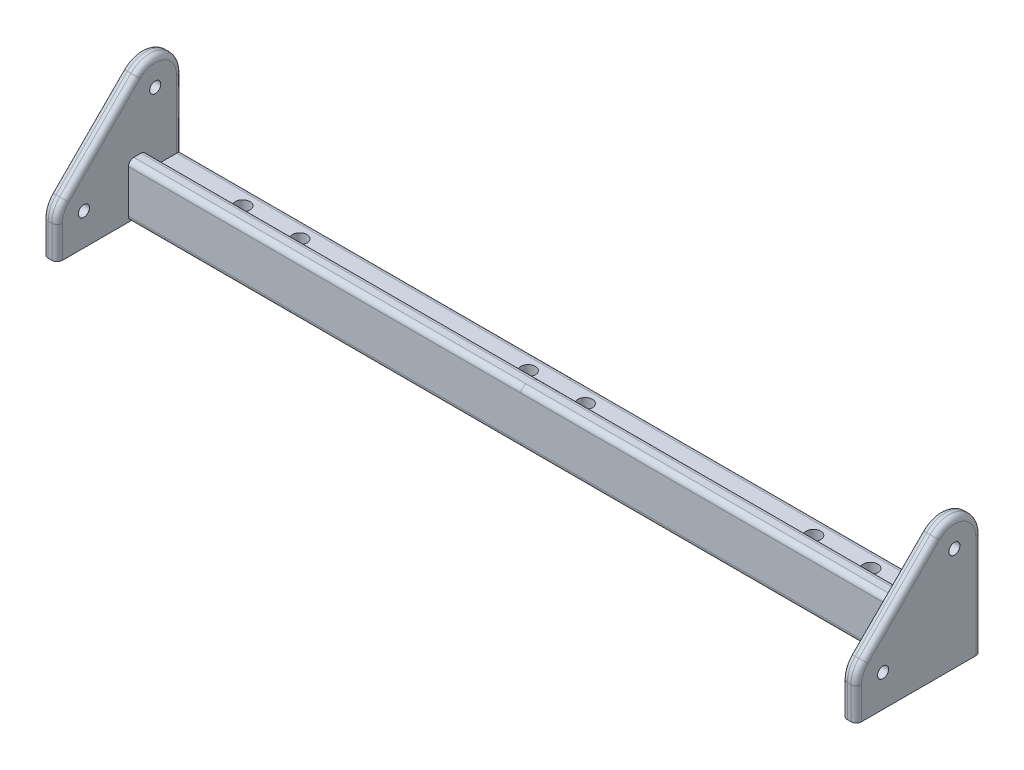
from build123d import *

# Parameters (mm, degrees)
BOSS_EXTRU_1_DEPTH      = 15
ESQUISSE2_R             = 1.55
ESQUISSE2_W             = 15
ESQUISSE2_H             = 10
BOSS_EXTRU_2_DEPTH      = 4
ESQUISSE5_R             = 2.05
ENL_V_MAT_EXTRU_3_DEPTH = 125.712669765
ESQUISSE7_W             = 110
ESQUISSE7_H             = 5
BOSS_EXTRU_3_DEPTH      = 5
CONG_1_R                = 1.5
CONG_1_OF_SYM_TRIE5_R   = 1.5


with BuildPart() as part:
    # Esquisse1 → Boss.-Extru.1 (new body)
    with BuildSketch(Plane.XY):
        Polygon((0, 10), (0, 5), (0, 0), (110, 0), (110, 10), align=None)
    boss_extru_1 = extrude(amount=BOSS_EXTRU_1_DEPTH)

    # Esquisse2 → Boss.-Extru.2 (add)
    # profile 1 of 2: a face of its own
    with BuildSketch(Plane(origin=(110, 0, 0), x_dir=(0, 0, -1), z_dir=(1, 0, 0))):
        with BuildLine():
            ThreePointArc((0, 29), (-4.629874257, 35.929096494), (-12.803300859, 34.303300859))
            Line((-12.803300859, 34.303300859), (-32.803300859, 14.303300859))
            ThreePointArc((-32.803300859, 14.303300859), (-34.429096494, 11.870125743), (-35, 9))
            Line((-35, 9), (-35, 0))
            Line((-35, 0), (-15, 0))
            Line((-15, 0), (-15, 10))
            Line((-15, 10), (0, 10))
            Line((0, 10), (0, 29))
        make_face()
        with Locations((-27.5, 9)):
            Circle(ESQUISSE2_R, mode=Mode.SUBTRACT)
        with Locations((-7.5, 29)):
            Circle(ESQUISSE2_R, mode=Mode.SUBTRACT)
    # profile 2 of 2: a face of its own
    with BuildSketch(Plane(origin=(110, 0, 0), x_dir=(0, 0, -1), z_dir=(1, 0, 0))):
        with Locations((-7.5, 5)):
            Rectangle(ESQUISSE2_W, ESQUISSE2_H)
    boss_extru_2 = extrude(amount=BOSS_EXTRU_2_DEPTH)

    # Esquisse5 → Enlèv. mat.-Extru.3 (cut, through all)
    with BuildSketch(Plane.XZ):
        with Locations(Location((8, 5, 0), (0, 0, 270))):
            Circle(ESQUISSE5_R)
        with Locations(Location((72, 5, 0), (0, 0, 270))):
            Circle(ESQUISSE5_R)
        with Locations((88, 5)):
            Circle(ESQUISSE5_R)
    enl_v_mat_extru_3 = extrude(amount=-ENL_V_MAT_EXTRU_3_DEPTH, mode=Mode.SUBTRACT)

    # Esquisse7 → Boss.-Extru.3 (add)
    with BuildSketch(Plane(origin=(0, 10, 0), x_dir=(1, 0, 0), z_dir=(0, 1, 0))):
        with Locations((55, -12.5)):
            Rectangle(ESQUISSE7_W, ESQUISSE7_H)
    boss_extru_3 = extrude(amount=BOSS_EXTRU_3_DEPTH)

    # Congé1
    cong_1_edges = [part.edges().sort_by_distance(p)[0] for p in [
        (110, 35.929096494, 4.629874257),
        (110, 24.303300859, 22.803300859),
        (110, 11.870125743, 34.429096494),
        (110, 4.5, 35),
        (114, 14.5, 0),
        (110, 19.5, 0),
        (114, 35.929096494, 4.629874257),
        (114, 24.303300859, 22.803300859),
        (114, 11.870125743, 34.429096494),
        (114, 4.5, 35),
        (55, 0, 15),
        (55, 15, 10),
        (55, 15, 15),
        (55, 10, 10),
        (55, 10, 0),
    ]]
    fillet(cong_1_edges, radius=CONG_1_R)

    # Symétrie5: Boss.-Extru.1, Boss.-Extru.2, Enlèv. mat.-Extru.3, Boss.-Extru.3 across plane
    add(boss_extru_1.mirror(Plane(origin=(0, 5, 15), x_dir=(0, 0, 1), z_dir=(1, 0, 0))))
    add(boss_extru_2.mirror(Plane(origin=(0, 5, 15), x_dir=(0, 0, 1), z_dir=(1, 0, 0))))
    add(enl_v_mat_extru_3.mirror(Plane(origin=(0, 5, 15), x_dir=(0, 0, 1), z_dir=(1, 0, 0))), mode=Mode.SUBTRACT)
    add(boss_extru_3.mirror(Plane(origin=(0, 5, 15), x_dir=(0, 0, 1), z_dir=(1, 0, 0))))

    # Congé1 of Symétrie5
    cong_1_of_sym_trie5_edges = [part.edges().sort_by_distance(p)[0] for p in [
        (-110, 35.929096494, 4.629874257),
        (-110, 24.303300859, 22.803300859),
        (-110, 11.870125743, 34.429096494),
        (-110, 4.5, 35),
        (-114, 14.5, 0),
        (-110, 19.5, 0),
        (-114, 35.929096494, 4.629874257),
        (-114, 24.303300859, 22.803300859),
        (-114, 11.870125743, 34.429096494),
        (-114, 4.5, 35),
        (-55, 0, 15),
        (-55, 15, 10),
        (-55, 15, 15),
        (-55, 10, 10),
        (-55, 10, 0),
    ]]
    fillet(cong_1_of_sym_trie5_edges, radius=CONG_1_OF_SYM_TRIE5_R)


solid = part.part
